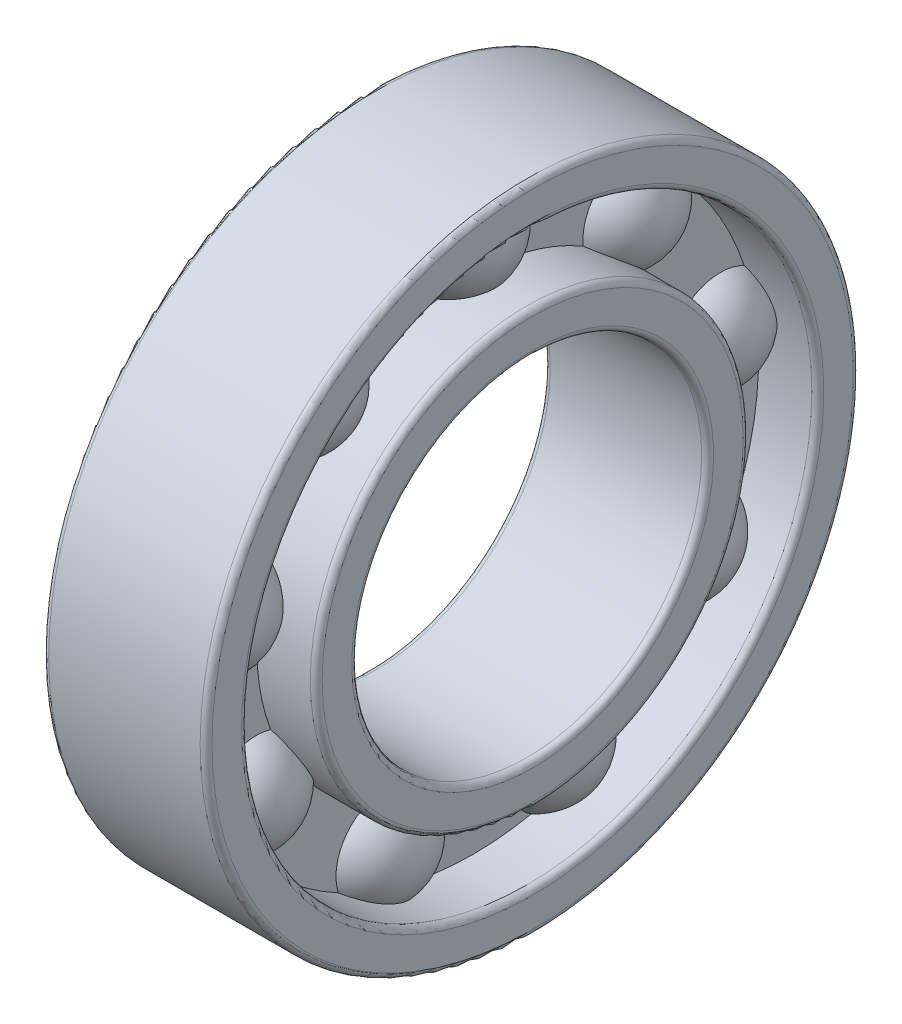
from build123d import *

# Parameters (mm, degrees)
CIRPATTERN1_COUNT = 9


with BuildPart() as part:
    # Sketch2 → Revolve1 (revolve)
    with BuildSketch(Plane.XY):
        with BuildLine():
            Line((3.246, 14), (-3.246, 14))
            ThreePointArc((-3.246, 14), (-3.425605122, 13.925605122), (-3.5, 13.746))
            Line((-3.5, 13.746), (-3.5, 12.476))
            ThreePointArc((-3.5, 12.476), (-3.425605122, 12.296394878), (-3.246, 12.222))
            Line((-3.246, 12.222), (-0.96, 12.222))
            Line((-0.96, 12.222), (-0.96, 9.278))
            Line((-0.96, 9.278), (-3.246, 9.278))
            ThreePointArc((-3.246, 9.278), (-3.425605122, 9.203605122), (-3.5, 9.024))
            Line((-3.5, 9.024), (-3.5, 7.754))
            ThreePointArc((-3.5, 7.754), (-3.425605122, 7.574394878), (-3.246, 7.5))
            Line((-3.246, 7.5), (3.246, 7.5))
            ThreePointArc((3.246, 7.5), (3.425605122, 7.574394878), (3.5, 7.754))
            Line((3.5, 7.754), (3.5, 9.024))
            ThreePointArc((3.5, 9.024), (3.425605122, 9.203605122), (3.246, 9.278))
            Line((3.246, 9.278), (0.96, 9.278))
            Line((0.96, 9.278), (0.96, 12.222))
            Line((0.96, 12.222), (3.246, 12.222))
            ThreePointArc((3.246, 12.222), (3.425605122, 12.296394878), (3.5, 12.476))
            Line((3.5, 12.476), (3.5, 13.746))
            ThreePointArc((3.5, 13.746), (3.425605122, 13.925605122), (3.246, 14))
        make_face()
    revolve(axis=Axis((-3.049373777, 0, 0), (1, 0, 0)))

    # Sketch3 → Revolve2 (revolve)
    with BuildSketch(Plane.XY):
        with BuildLine():
            Line((0, 13.163), (0, 8.337))
            ThreePointArc((0, 8.337), (2.413, 10.75), (0, 13.163))
        make_face()
    revolve2 = revolve(axis=Axis((0, 8.337, 0), (0, 1, 0)))

    # CirPattern1: Revolve2 ×9 about axis
    cirpattern1_axis = Axis((3.246, 0, 0), (-1, 0, 0))
    for i in range(1, CIRPATTERN1_COUNT):
        add(revolve2.rotate(cirpattern1_axis, i * 360 / CIRPATTERN1_COUNT))


solid = part.part
